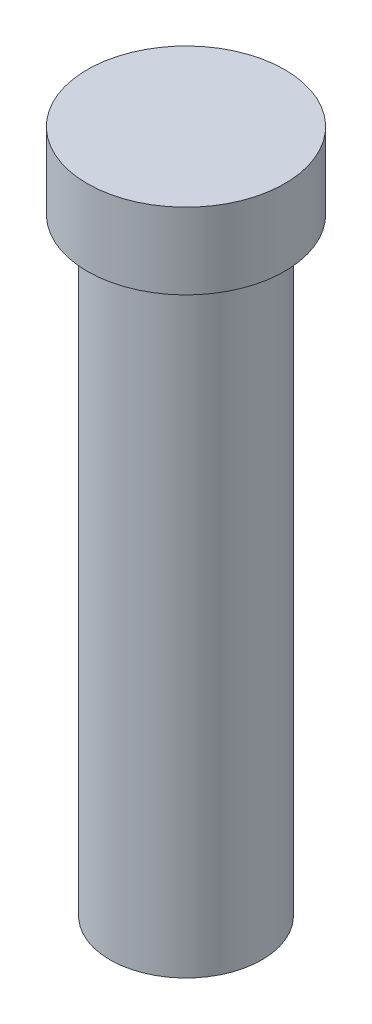
from build123d import *


with BuildPart() as part:
    # Sketch1 → Revolve1 (revolve)
    with BuildSketch(Plane.XY, mode=Mode.PRIVATE) as revolve1_sk:
        Polygon((0, 0), (6.5, 0), (6.5, -5), (5, -5), (5, -45), (0, -45), align=None)
    revolve(revolve1_sk.sketch.rotate(Axis((0, 8.476973089, 0), (0, -1, 0)), 90), axis=Axis((0, 8.476973089, 0), (0, -1, 0)))


solid = part.part
